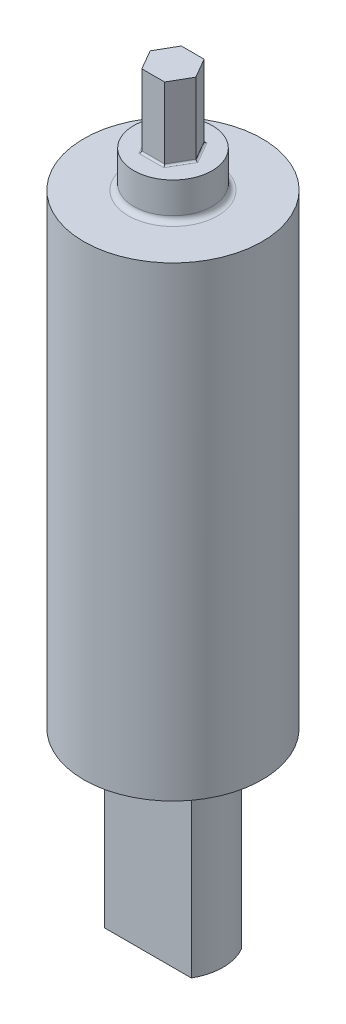
from build123d import *

# Parameters (mm, degrees)
CROQUIS5_R              = 4.9
SALIENTE_EXTRUIR1_DEPTH = 35.6
CROQUIS6_R              = 2.15
SALIENTE_EXTRUIR2_DEPTH = 2
SALIENTE_EXTRUIR3_DEPTH = 4
REDONDEO3_R             = 0.1
REDONDEO4_R             = 0.3
CORTAR_EXTRUIR1_START   = -10
CROQUIS8_R              = 4.9
CORTAR_EXTRUIR1_DEPTH   = 10
REDONDEO5_R             = 0.3


with BuildPart() as part:
    # Croquis5 → Saliente-Extruir1 (new body)
    with BuildSketch(Plane(origin=(0, 0, 0), x_dir=(1, 0, 0), z_dir=(0, 1, 0))):
        with Locations(Location((0, 0, 0), (0, 0, 270))):
            Circle(CROQUIS5_R)
    extrude(amount=-SALIENTE_EXTRUIR1_DEPTH)

    # Croquis6 → Saliente-Extruir2 (add)
    with BuildSketch(Plane(origin=(0, 0, 0), x_dir=(1, 0, 0), z_dir=(0, 1, 0))):
        with Locations(Location((0, 0, 0), (0, 0, 270))):
            Circle(CROQUIS6_R)
    extrude(amount=SALIENTE_EXTRUIR2_DEPTH)

    # Croquis7 → Saliente-Extruir3 (add)
    with BuildSketch(Plane(origin=(0, 2, 0), x_dir=(1, 0, 0), z_dir=(0, 1, 0))):
        Polygon((1.252850084, 0), (0.626425042, 1.085), (-0.626425042, 1.085), (-1.252850084, 0), (-0.626425042, -1.085), (0.626425042, -1.085), align=None)
    extrude(amount=SALIENTE_EXTRUIR3_DEPTH)

    # Redondeo3
    redondeo3_edges = [part.edges().sort_by_distance(p)[0] for p in [
        (0.939637563, 2, 0.5425),
        (0.939637563, 2, -0.5425),
        (0, 2, -1.085),
        (-0.939637563, 2, -0.5425),
        (-0.939637563, 2, 0.5425),
        (0, 2, 1.085),
    ]]
    fillet(redondeo3_edges, radius=REDONDEO3_R)

    # Redondeo4
    redondeo4_edges = [part.edges().sort_by_distance(p)[0] for p in [
        (0, 0, -2.15),
    ]]
    fillet(redondeo4_edges, radius=REDONDEO4_R)

    # Croquis8 → Cortar-Extruir1 (cut)
    with BuildSketch(Plane.XZ.offset(35.6).offset(CORTAR_EXTRUIR1_START)):
        with Locations(Location((0, 0, 0), (0, 0, 90))):
            Circle(CROQUIS8_R)
        with BuildLine():
            ThreePointArc((-2.38156986, 1.375), (-2.75, 0), (-2.38156986, -1.375))
            Line((-2.38156986, -1.375), (2.38156986, -1.375))
            ThreePointArc((2.38156986, -1.375), (2.75, 0), (2.38156986, 1.375))
            Line((2.38156986, 1.375), (-2.38156986, 1.375))
        make_face(mode=Mode.SUBTRACT)
    extrude(amount=CORTAR_EXTRUIR1_DEPTH, mode=Mode.SUBTRACT)

    # Redondeo5
    redondeo5_edges = [part.edges().sort_by_distance(p)[0] for p in [
        (0, -25.6, 1.375),
        (-2.75, -25.6, 0),
        (0, -25.6, -1.375),
        (2.75, -25.6, 0),
    ]]
    fillet(redondeo5_edges, radius=REDONDEO5_R)


solid = part.part
